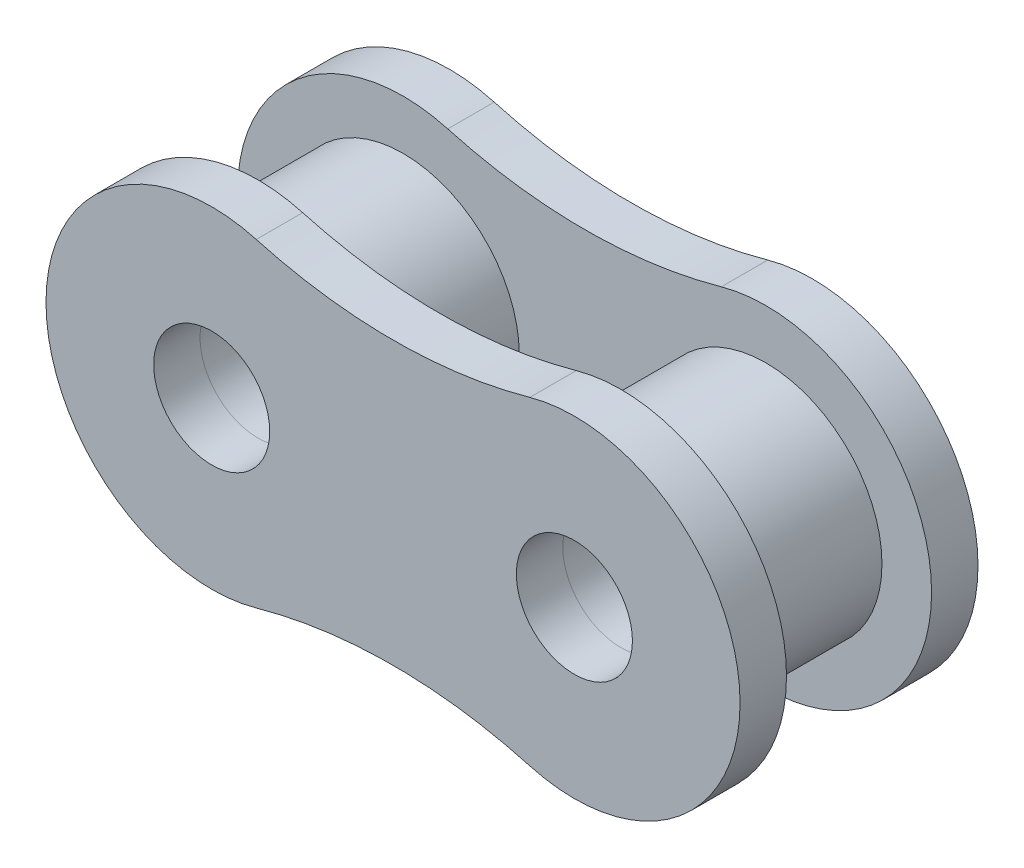
from build123d import *

# Parameters (mm, degrees)
SKETCH4_R                  = 5.08
SKETCH4_R_2                = 2.5654
BOSS_EXTRUDE1_DEPTH        = 3.175
BOSS_EXTRUDE1_2_DEPTH      = 3.175
SKETCH5_R                  = 2.54
BOSS_EXTRUDE2_DEPTH        = 2.032
LPATTERN1_COUNT            = 2
LPATTERN1_PITCH            = 15.875
SKETCH7_R                  = 2.54
BOSS_EXTRUDE3_DEPTH        = 2.032
BOSS_EXTRUDE4_DEPTH        = 10.16
BOSS_EXTRUDE4_DEPTH_BACK   = 10.16
SKETCH8_R                  = 2.54
BOSS_EXTRUDE4_2_DEPTH      = 10.16
BOSS_EXTRUDE4_2_DEPTH_BACK = 10.16


with BuildPart() as part:
    # Sketch4 → Boss-Extrude1 (new, symmetric)
    with BuildSketch(Plane.XY):
        with Locations((-7.9375, 0)):
            Circle(SKETCH4_R)
        with Locations((-7.9375, 0)):
            Circle(SKETCH4_R_2, mode=Mode.SUBTRACT)
    extrude(amount=BOSS_EXTRUDE1_DEPTH, both=True)


with BuildPart() as body_2:
    # Sketch4 → Boss-Extrude1 2 (new, symmetric)
    with BuildSketch(Plane.XY):
        with Locations((7.9375, 0)):
            Circle(SKETCH4_R)
        with Locations((7.9375, 0)):
            Circle(SKETCH4_R_2, mode=Mode.SUBTRACT)
    extrude(amount=BOSS_EXTRUDE1_2_DEPTH, both=True)


with BuildPart() as body_3:
    # Sketch5 → Boss-Extrude2 (new body)
    with BuildSketch(Plane.XY.offset(3.175)):
        with BuildLine():
            ThreePointArc((-5.986592041, 6.984347573), (-15.1892, 0), (-5.986592041, -6.984347573))
            ThreePointArc((-5.986592041, -6.984347573), (0, -6.163945), (5.986592041, -6.984347573))
            ThreePointArc((5.986592041, -6.984347573), (15.1892, 0), (5.986592041, 6.984347573))
            ThreePointArc((5.986592041, 6.984347573), (0, 6.163945), (-5.986592041, 6.984347573))
        make_face()
        with Locations((-7.9375, 0)):
            Circle(SKETCH5_R, mode=Mode.SUBTRACT)
        with Locations((7.9375, 0)):
            Circle(SKETCH5_R, mode=Mode.SUBTRACT)
    extrude(amount=BOSS_EXTRUDE2_DEPTH)


with BuildPart() as lpattern1_1:
    # LPattern1: pattern copy
    add(body_2.part.moved(Location(Vector(1, 0, 0) * (1 * LPATTERN1_PITCH))))


with BuildPart() as body_5:
    # Sketch7 → Boss-Extrude3 (new body)
    with BuildSketch(Plane.XY.offset(-5.2578)):
        with BuildLine():
            ThreePointArc((9.706473173, 6.131412978), (1.556004, 0), (9.706473173, -6.131412978))
            ThreePointArc((9.706473173, -6.131412978), (15.875, -5.259356889), (22.043526827, -6.131412978))
            ThreePointArc((22.043526827, -6.131412978), (30.193996, 0), (22.043526827, 6.131412978))
            ThreePointArc((22.043526827, 6.131412978), (15.875, 5.259356889), (9.706473173, 6.131412978))
        make_face()
        with Locations((7.9375, 0)):
            Circle(SKETCH7_R, mode=Mode.SUBTRACT)
        with Locations((23.8125, 0)):
            Circle(SKETCH7_R, mode=Mode.SUBTRACT)
    extrude(amount=-BOSS_EXTRUDE3_DEPTH)


with BuildPart() as body_6:
    # Mirror1: mirrored copy
    add(body_3.part.mirror(Plane.XY))


with BuildPart() as body_7:
    # Mirror1 2: mirrored copy
    add(body_5.part.mirror(Plane.XY))


with BuildPart() as body_8:
    # Sketch8 → Boss-Extrude4 (new, two sides: drawn at the far end of the back side and taken through both)
    with BuildSketch(Plane.XY.offset(-BOSS_EXTRUDE4_DEPTH_BACK)):
        with Locations((7.9375, 0)):
            Circle(SKETCH8_R)
    extrude(amount=BOSS_EXTRUDE4_DEPTH + BOSS_EXTRUDE4_DEPTH_BACK)


with BuildPart() as body_9:
    # Sketch8 → Boss-Extrude4 2 (new, two sides: drawn at the far end of the back side and taken through both)
    with BuildSketch(Plane.XY.offset(-BOSS_EXTRUDE4_2_DEPTH_BACK)):
        with Locations((23.8125, 0)):
            Circle(SKETCH8_R)
    extrude(amount=BOSS_EXTRUDE4_2_DEPTH + BOSS_EXTRUDE4_2_DEPTH_BACK)


solid = Compound([part.part, body_2.part, body_3.part, body_6.part])
